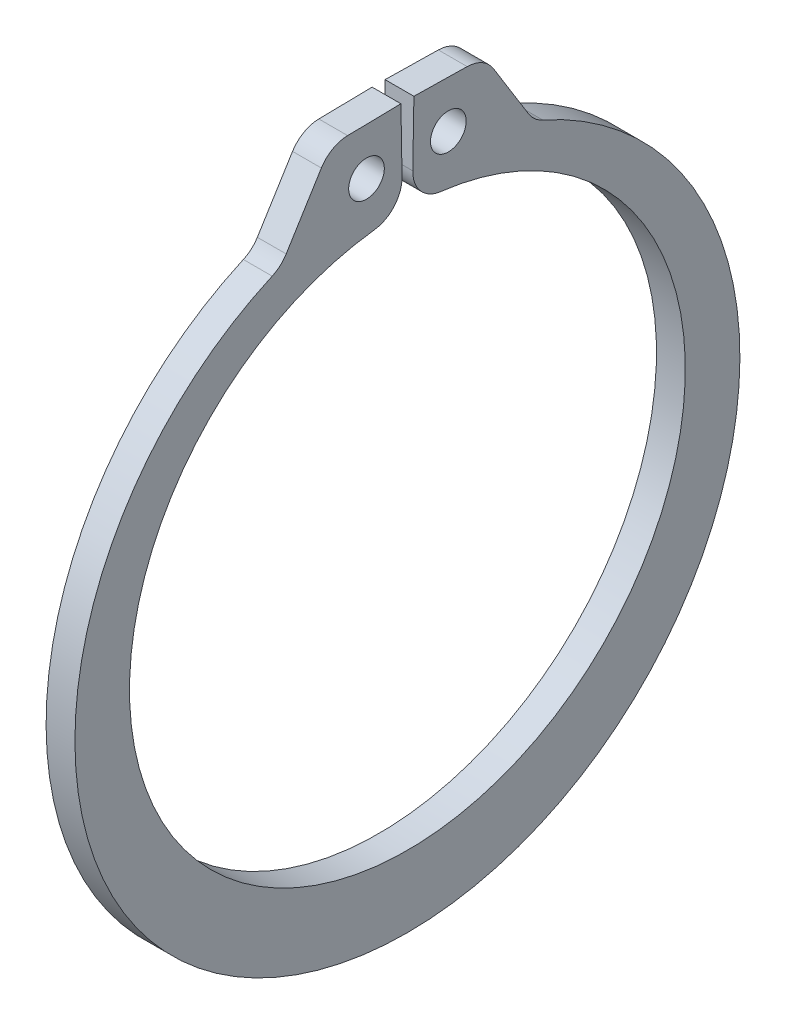
from build123d import *

# Parameters (mm, degrees)
BOSS_EXTRUDE1_DEPTH      = 0.5334
BOSS_EXTRUDE1_DEPTH_BACK = 0.5334
SKETCH3_R                = 0.6604
FILLET1_R                = 1.1684


with BuildPart() as part:
    # Sketch3 → Boss-Extrude1 (new, two sides: drawn at the far end of the back side and taken through both)
    with BuildSketch(Plane(origin=(0, 0, 0), x_dir=(0, 0, -1), z_dir=(1, 0, 0)).offset(-BOSS_EXTRUDE1_DEPTH_BACK)):
        with BuildLine():
            Line((-2.849716296, 13.719155087), (-4.681521945, 10.760524305))
            ThreePointArc((-4.681521945, 10.760524305), (0, -12.9286), (4.681521945, 10.760524305))
            Line((4.681521945, 10.760524305), (2.849716296, 13.719155087))
            Line((2.849716296, 13.719155087), (0.240263789, 13.76470325))
            Line((0.240263789, 13.76470325), (0.179532905, 10.28543324))
            ThreePointArc((0.179532905, 10.28543324), (0, -10.287), (-0.179532905, 10.28543324))
            Line((-0.179532905, 10.28543324), (-0.240263789, 13.76470325))
            Line((-0.240263789, 13.76470325), (-2.849716296, 13.719155087))
        make_face()
        with Locations((-1.514624601, 12.002294163)):
            Circle(SKETCH3_R, mode=Mode.SUBTRACT)
        with Locations((1.514624601, 12.002294163)):
            Circle(SKETCH3_R, mode=Mode.SUBTRACT)
    extrude(amount=BOSS_EXTRUDE1_DEPTH + BOSS_EXTRUDE1_DEPTH_BACK)

    # Fillet1
    fillet1_edges = [part.edges().sort_by_distance(p)[0] for p in [
        (0, 10.760524305, 4.681521945),
        (0, 13.719155087, 2.849716296),
        (0, 10.28543324, 0.179532905),
        (0, 10.28543324, -0.179532905),
        (0, 13.719155087, -2.849716296),
        (0, 10.760524305, -4.681521945),
    ]]
    fillet(fillet1_edges, radius=FILLET1_R)


solid = part.part
